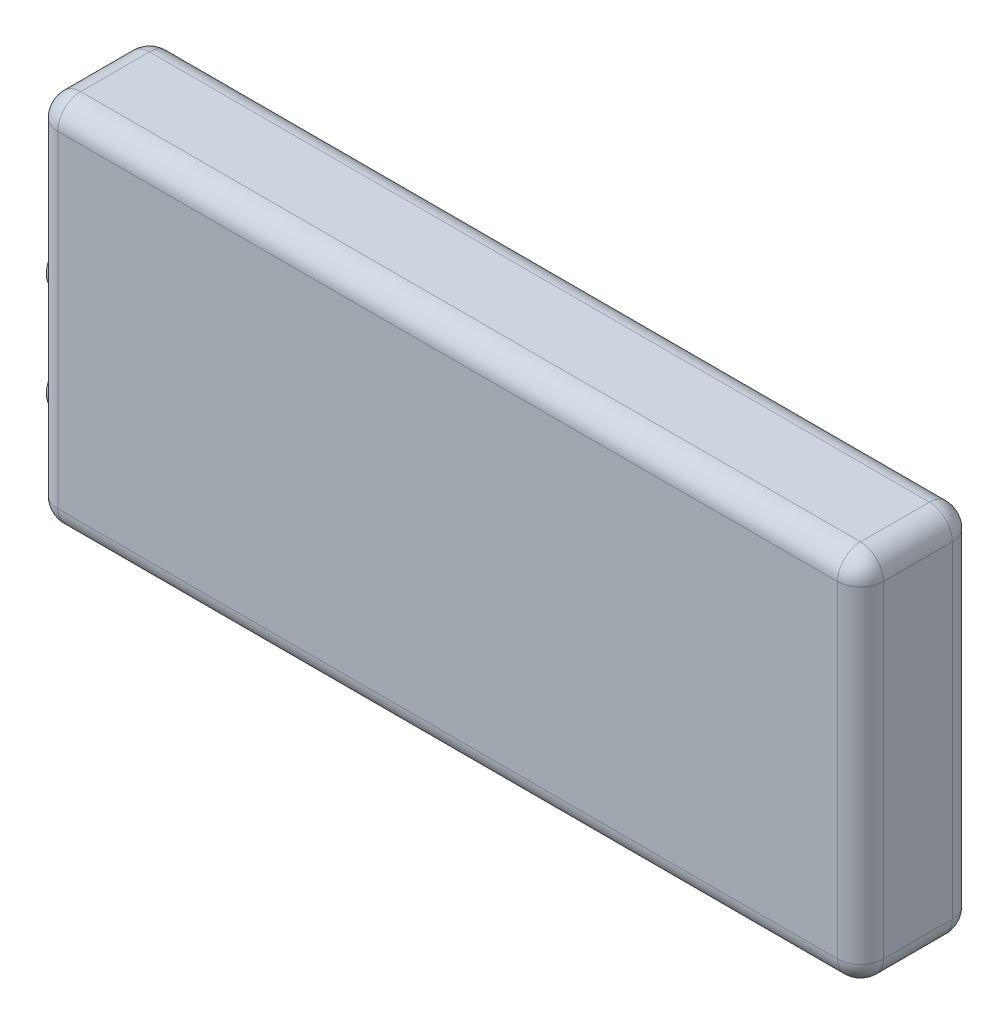
from build123d import *

# Parameters (mm, degrees)
SKETCH1_W           = 72
SKETCH1_H           = 32.5
BOSS_EXTRUDE1_DEPTH = 10
FILLET2_R           = 2
SKETCH2_R           = 3
SKETCH2_R_2         = 2
CUT_EXTRUDE1_DEPTH  = 3
BOSS_EXTRUDE2_START = 2
SKETCH3_R           = 2
BOSS_EXTRUDE2_DEPTH = 2
CUT_EXTRUDE2_DEPTH  = 1


with BuildPart() as part:
    # Sketch1 → Boss-Extrude1 (new body)
    with BuildSketch(Plane.XY):
        Rectangle(SKETCH1_W, SKETCH1_H)
    extrude(amount=BOSS_EXTRUDE1_DEPTH)

    # Fillet2
    fillet2_edges = [part.edges().sort_by_distance(p)[0] for p in [
        (-36, 0, 10),
        (0, -16.25, 10),
        (36, 0, 10),
        (0, -16.25, 0),
        (-36, 0, 0),
        (0, 16.25, 0),
        (36, 0, 0),
        (0, 16.25, 10),
        (36, -16.25, 5),
        (-36, -16.25, 5),
        (-36, 16.25, 5),
        (36, 16.25, 5),
    ]]
    fillet(fillet2_edges, radius=FILLET2_R)

    # Sketch2 → Cut-Extrude1 (cut)
    # profile 1 of 2: a face of its own
    with BuildSketch(Plane.ZY.offset(36)):
        with Locations(Location((5, 0, 0), (0, 0, 270))):
            Circle(SKETCH2_R)
        with Locations(Location((5, 0, 0), (0, 0, 270))):
            Circle(SKETCH2_R_2, mode=Mode.SUBTRACT)
    # profile 2 of 2: a face of its own
    with BuildSketch(Plane.ZY.offset(36)):
        with Locations(Location((5, -9.040456428, 0), (0, 0, 270))):
            Circle(SKETCH2_R)
        with Locations(Location((5, -9.040456428, 0), (0, 0, 270))):
            Circle(SKETCH2_R_2, mode=Mode.SUBTRACT)
    extrude(amount=-CUT_EXTRUDE1_DEPTH, mode=Mode.SUBTRACT)

    # Sketch3 → Boss-Extrude2 (add)
    with BuildSketch(Plane.ZY.offset(36).offset(BOSS_EXTRUDE2_START)):
        with Locations(Location((5, -9.040456428, 0), (0, 0, 270))):
            Circle(SKETCH3_R)
        with Locations(Location((5, 0, 0), (0, 0, 270))):
            Circle(SKETCH3_R)
    extrude(amount=-BOSS_EXTRUDE2_DEPTH)

    # Sketch4 → Cut-Extrude2 (cut)
    with BuildSketch(Plane(origin=(0, 0, 0), x_dir=(-1, 0, 0), z_dir=(0, 0, -1))):
        Polygon((-4.372559178, 2.480803128), (-2.487943794, 2.480803128), (-2.487943794, 1.852598), (-3.74435405, 1.852598), (-3.74435405, 1.179521077), (-2.487943794, 1.179521077), (-2.487943794, 0.551315949), (-3.74435405, 0.551315949), (-3.74435405, -0.390991744), (-2.487943794, -0.390991744), (-2.487943794, -1.019196872), (-4.372559178, -1.019196872), align=None)
        with BuildLine():
            Line((-0.06486687, 2.013154891), (-0.534618473, 1.583367231))
            add(Edge.make_bspline(
                [(-0.534618473, 1.583367231), (-0.554740617, 1.611751607), (-0.593372329, 1.666245652), (-0.655990303, 1.739214462), (-0.718325525, 1.801462288), (-0.780955493, 1.852729086), (-0.844435334, 1.892703372), (-0.908654858, 1.921005609), (-0.973249986, 1.938997609), (-1.01664794, 1.941238046), (-1.038023922, 1.94234159)],
                knots=[0, 0, 0, 0, 1.299362458, 2.494594718, 3.587462134, 4.587049575, 5.512617175, 6.380583204, 7.202344345, 8, 8, 8, 8], degree=3))
            add(Edge.make_bspline(
                [(-1.038023922, 1.94234159), (-1.057962824, 1.941642334), (-1.096459607, 1.940292254), (-1.151339626, 1.926872565), (-1.200062889, 1.903712153), (-1.242581843, 1.873427965), (-1.276263128, 1.83694254), (-1.303155022, 1.798678711), (-1.318297418, 1.756444096), (-1.320290455, 1.72743566), (-1.321277127, 1.713074763)],
                knots=[0, 0, 0, 0, 1.185010067, 2.2879431, 3.333075148, 4.379039566, 5.372662701, 6.27520591, 7.14612461, 8, 8, 8, 8], degree=3))
            add(Edge.make_bspline(
                [(-1.321277127, 1.713074763), (-1.32065883, 1.698506775), (-1.319413665, 1.669168873), (-1.307387071, 1.626170523), (-1.28925956, 1.58415613), (-1.271937984, 1.55857997), (-1.263084018, 1.545506654)],
                knots=[0, 0, 0, 0, 0.967525499, 1.948461899, 2.951351359, 4, 4, 4, 4], degree=3))
            add(Edge.make_bspline(
                [(-1.263084018, 1.545506654), (-1.255034805, 1.535344902), (-1.236506581, 1.511953892), (-1.201177052, 1.474906177), (-1.156810583, 1.429519485), (-1.101699859, 1.377354529), (-1.038132679, 1.316535254), (-0.96316262, 1.249452489), (-0.878947649, 1.174028759), (-0.819089598, 1.121506404), (-0.787723441, 1.093984218)],
                knots=[0, 0, 0, 0, 0.473873513, 1.090794244, 1.870441696, 2.795289791, 3.865433203, 5.087734844, 6.473946851, 8, 8, 8, 8], degree=3))
            add(Edge.make_bspline(
                [(-0.787723441, 1.093984218), (-0.758281791, 1.068503954), (-0.702407655, 1.020147708), (-0.622909855, 0.95151378), (-0.553044529, 0.889765509), (-0.491793899, 0.835829604), (-0.440086464, 0.789140154), (-0.397704847, 0.749473983), (-0.364131427, 0.717603319), (-0.345046904, 0.698353419), (-0.336902127, 0.690138064)],
                knots=[0, 0, 0, 0, 1.543621617, 2.929473131, 4.163658386, 5.240097082, 6.164993805, 6.925417477, 7.541396219, 8, 8, 8, 8], degree=3))
            add(Edge.make_bspline(
                [(-0.336902127, 0.690138064), (-0.306002542, 0.656698096), (-0.24660269, 0.592414733), (-0.169403821, 0.492795739), (-0.105866655, 0.395547287), (-0.056713098, 0.298839491), (-0.019590355, 0.20127705), (0.006581671, 0.10046725), (0.022256271, -0.004643308), (0.023996517, -0.076368433), (0.024876719, -0.112646391)],
                knots=[0, 0, 0, 0, 1.206664779, 2.319633467, 3.337109185, 4.282041471, 5.190008762, 6.099243693, 7.03861361, 8, 8, 8, 8], degree=3))
            add(Edge.make_bspline(
                [(0.024876719, -0.112646391), (0.024250214, -0.147994813), (0.023020988, -0.217349731), (0.00796532, -0.318840323), (-0.013503179, -0.415971225), (-0.046697243, -0.507685514), (-0.087153973, -0.595488654), (-0.137872326, -0.678012949), (-0.197434078, -0.75609358), (-0.265700991, -0.82833476), (-0.341212303, -0.893888624), (-0.422205362, -0.952246222), (-0.509472158, -1.000427852), (-0.602267097, -1.040101988), (-0.70054051, -1.070659538), (-0.804175322, -1.093244415), (-0.913330049, -1.106799503), (-0.987971625, -1.108216526), (-1.026104851, -1.108940462)],
                knots=[0, 0, 0, 0, 1.043214005, 2.046824704, 3.02475056, 3.976699089, 4.921714032, 5.875962561, 6.831408892, 7.817874052, 8.806269674, 9.781291748, 10.760897367, 11.74438705, 12.757449933, 13.795994037, 14.874007457, 16, 16, 16, 16], degree=3))
            add(Edge.make_bspline(
                [(-1.026104851, -1.108940462), (-1.056039109, -1.108409408), (-1.115326107, -1.107357617), (-1.202706178, -1.098770621), (-1.287081515, -1.084912121), (-1.368357076, -1.065048752), (-1.446899021, -1.03987917), (-1.522710577, -1.009135489), (-1.595268391, -0.972341194), (-1.66512147, -0.930252922), (-1.731930242, -0.881382895), (-1.796539477, -0.826730243), (-1.858307415, -0.765454385), (-1.917530715, -0.697700236), (-1.973830449, -0.623275932), (-2.029049511, -0.54321797), (-2.080733799, -0.456040582), (-2.112661483, -0.394884939), (-2.128969435, -0.363647994)],
                knots=[0, 0, 0, 0, 1.016823716, 2.013894106, 2.979844003, 3.91962641, 4.853723003, 5.779685073, 6.695824784, 7.614987388, 8.547259901, 9.504950863, 10.487499108, 11.500346958, 12.559593716, 13.656357062, 14.802919212, 16, 16, 16, 16], degree=3))
            Line((-2.128969435, -0.363647994), (-1.57648546, -0.032017385))
            add(Edge.make_bspline(
                [(-1.57648546, -0.032017385), (-1.55608665, -0.067475399), (-1.516980386, -0.135451442), (-1.450711167, -0.226785871), (-1.382821735, -0.30499869), (-1.311742547, -0.368707484), (-1.238337901, -0.418764121), (-1.162253233, -0.454538066), (-1.083435089, -0.476682098), (-1.02974775, -0.479386396), (-1.002967832, -0.480735334)],
                knots=[0, 0, 0, 0, 1.283663364, 2.460892379, 3.537111102, 4.529833553, 5.449777664, 6.316464042, 7.160231139, 8, 8, 8, 8], degree=3))
            add(Edge.make_bspline(
                [(-1.002967832, -0.480735334), (-0.975728821, -0.479633718), (-0.922881173, -0.477496423), (-0.847447917, -0.457754876), (-0.778287853, -0.426759199), (-0.718506403, -0.382532642), (-0.667887241, -0.331488473), (-0.630527394, -0.274699501), (-0.607057686, -0.213255204), (-0.604576369, -0.170571954), (-0.603328409, -0.149104725)],
                knots=[0, 0, 0, 0, 1.13588714, 2.203786484, 3.234766741, 4.283437687, 5.291419208, 6.222934724, 7.106237994, 8, 8, 8, 8], degree=3))
            add(Edge.make_bspline(
                [(-0.603328409, -0.149104725), (-0.604480849, -0.129132961), (-0.606821921, -0.088562236), (-0.624065537, -0.028240092), (-0.651022568, 0.03205462), (-0.682914637, 0.081509973), (-0.71536881, 0.1229176), (-0.74640232, 0.158795435), (-0.784192926, 0.198434162), (-0.828644807, 0.241883644), (-0.879170638, 0.289526376), (-0.935812981, 0.341357694), (-0.99922045, 0.396921026), (-1.044036974, 0.434770218), (-1.067471037, 0.454561141)],
                knots=[0, 0, 0, 0, 0.916159276, 1.861089862, 2.860218735, 3.940849679, 4.552606315, 5.27541173, 6.11797699, 7.06649574, 8.129236253, 9.306560635, 10.591630461, 12, 12, 12, 12], degree=3))
            add(Edge.make_bspline(
                [(-1.067471037, 0.454561141), (-1.112020124, 0.49225394), (-1.197523304, 0.56459783), (-1.318350147, 0.671447478), (-1.427225951, 0.771308265), (-1.523210347, 0.865414688), (-1.607526326, 0.952028819), (-1.679602864, 1.031854173), (-1.738648166, 1.105506492), (-1.800780615, 1.192742734), (-1.859818863, 1.29904609), (-1.910844664, 1.426941351), (-1.94394805, 1.554820383), (-1.947656824, 1.640671322), (-1.949482255, 1.682926525)],
                knots=[0, 0, 0, 0, 1.345494975, 2.582412109, 3.71882943, 4.751509156, 5.681369928, 6.505683931, 7.230279997, 7.856715994, 8.973648664, 10.023341002, 11.027102913, 12, 12, 12, 12], degree=3))
            add(Edge.make_bspline(
                [(-1.949482255, 1.682926525), (-1.948723061, 1.712891648), (-1.947227366, 1.771926158), (-1.933885539, 1.858727803), (-1.913945669, 1.942484097), (-1.884987255, 2.022889459), (-1.847402729, 2.099843179), (-1.801757782, 2.173721976), (-1.747343635, 2.243845887), (-1.686022565, 2.310168425), (-1.618462446, 2.370779677), (-1.546265873, 2.42427518), (-1.469841485, 2.46945826), (-1.389656808, 2.506940906), (-1.305214971, 2.53563149), (-1.217138052, 2.555968806), (-1.125299722, 2.568064793), (-1.062833273, 2.569709102), (-1.031012704, 2.570546718)],
                knots=[0, 0, 0, 0, 1.010766082, 1.991317756, 2.957454644, 3.913069143, 4.869106762, 5.843196583, 6.838735724, 7.860187025, 8.887984031, 9.89767229, 10.887916223, 11.879572884, 12.879850636, 13.892031539, 14.926195476, 16, 16, 16, 16], degree=3))
            add(Edge.make_bspline(
                [(-1.031012704, 2.570546718), (-0.989774821, 2.569038148), (-0.907624573, 2.566032917), (-0.786163063, 2.542532992), (-0.667524537, 2.505576884), (-0.57192339, 2.460993406), (-0.495855342, 2.41780537), (-0.437556288, 2.378043267), (-0.378233863, 2.33249364), (-0.317409669, 2.281012952), (-0.256213912, 2.222631238), (-0.192906504, 2.15873832), (-0.128350087, 2.088782015), (-0.086398652, 2.038805555), (-0.06486687, 2.013154891)],
                knots=[0, 0, 0, 0, 1.282922637, 2.555718331, 3.837320111, 5.142675274, 5.830281639, 6.55870424, 7.337177975, 8.157850921, 9.037902056, 9.96903443, 10.957596896, 12, 12, 12, 12], degree=3))
        make_face()
        with BuildLine():
            Line((3.794107488, 1.873631654), (3.333470469, 1.433327166))
            add(Edge.make_bspline(
                [(3.333470469, 1.433327166), (3.294395485, 1.473730766), (3.218069798, 1.552651654), (3.095080393, 1.657135955), (2.96717589, 1.744209483), (2.836844415, 1.817542253), (2.701741684, 1.873023721), (2.563429852, 1.913454), (2.421025757, 1.938102814), (2.324652142, 1.940923074), (2.276178803, 1.94234159)],
                knots=[0, 0, 0, 0, 1.115251505, 2.178435587, 3.19620269, 4.182487026, 5.141301733, 6.088180966, 7.038406374, 8, 8, 8, 8], degree=3))
            add(Edge.make_bspline(
                [(2.276178803, 1.94234159), (2.235697673, 1.941220913), (2.155812625, 1.939009381), (2.03852044, 1.922796671), (1.926324403, 1.895226252), (1.81884045, 1.857229107), (1.716384856, 1.808062818), (1.618742811, 1.747765439), (1.526155048, 1.676881541), (1.439844596, 1.59577788), (1.360890828, 1.507166035), (1.291130146, 1.412617409), (1.232694385, 1.312348606), (1.184737107, 1.207375075), (1.14738024, 1.097210946), (1.120702745, 0.981930388), (1.105273194, 0.861396108), (1.10297023, 0.779457803), (1.101799796, 0.737814346)],
                knots=[0, 0, 0, 0, 1.035432265, 2.043311493, 3.022114605, 3.98653278, 4.95457646, 5.923598177, 6.917315552, 7.932509744, 8.948865224, 9.949768934, 10.933144597, 11.912367597, 12.897413939, 13.903909035, 14.934704909, 16, 16, 16, 16], degree=3))
            add(Edge.make_bspline(
                [(1.101799796, 0.737814346), (1.102137102, 0.708586054), (1.102801938, 0.65097649), (1.11007975, 0.565755956), (1.121798742, 0.483071892), (1.138759027, 0.40304954), (1.159968031, 0.325619553), (1.184851021, 0.250113948), (1.216066367, 0.17757604), (1.250715871, 0.107163349), (1.291012846, 0.040797175), (1.334460418, -0.022488481), (1.381572216, -0.082383397), (1.432653387, -0.138642722), (1.488422834, -0.190387248), (1.547439123, -0.239172995), (1.610697777, -0.28377869), (1.676884755, -0.325323762), (1.746571827, -0.36141432), (1.817868221, -0.394105393), (1.891854936, -0.420655405), (1.967631138, -0.442057137), (2.04492603, -0.460256113), (2.124495627, -0.471461782), (2.205650161, -0.479947704), (2.260497004, -0.48047166), (2.288097873, -0.480735334)],
                knots=[0, 0, 0, 0, 1.103660481, 2.175337485, 3.227646561, 4.255952547, 5.262355991, 6.258840057, 7.255597736, 8.242457506, 9.22035537, 10.185017736, 11.140346927, 12.096287581, 13.051739095, 14.01125915, 14.986044842, 15.97314143, 16.960198552, 17.947847494, 18.933482797, 19.925264591, 20.920966487, 21.929612487, 22.958107872, 24, 24, 24, 24], degree=3))
            add(Edge.make_bspline(
                [(2.288097873, -0.480735334), (2.33491369, -0.479381172), (2.426894596, -0.476720596), (2.561889802, -0.455915269), (2.690526784, -0.421691683), (2.793307118, -0.381275617), (2.873832794, -0.341364227), (2.935135801, -0.304448157), (2.998527888, -0.26315348), (3.062956167, -0.215921689), (3.129145328, -0.163319585), (3.19592698, -0.104195084), (3.265010745, -0.040495071), (3.310266834, 0.00496888), (3.333470469, 0.02827909)],
                knots=[0, 0, 0, 0, 1.404581149, 2.759636711, 4.088442092, 5.392261763, 6.066678138, 6.783632037, 7.538459478, 8.336747902, 9.180226004, 10.074962426, 11.012997595, 12, 12, 12, 12], degree=3))
            Line((3.333470469, 0.02827909), (3.780085053, -0.440771391))
            add(Edge.make_bspline(
                [(3.780085053, -0.440771391), (3.748690451, -0.471081893), (3.687414904, -0.530241511), (3.594982441, -0.614242647), (3.502666308, -0.689727007), (3.412696671, -0.75943434), (3.323599732, -0.821333904), (3.235384941, -0.875487517), (3.149050927, -0.923264804), (3.062804938, -0.963860023), (2.976110305, -0.998329581), (2.886911716, -1.028005607), (2.794936482, -1.053110458), (2.699622861, -1.073366776), (2.601859879, -1.089609608), (2.500732605, -1.100573426), (2.396882237, -1.107944035), (2.326438923, -1.108606346), (2.29090236, -1.108940462)],
                knots=[0, 0, 0, 0, 1.244526981, 2.429050516, 3.560637417, 4.644440555, 5.67424972, 6.652764056, 7.595344123, 8.486817594, 9.369275933, 10.254498637, 11.166417451, 12.086725134, 13.032340136, 13.991389299, 14.986715468, 16, 16, 16, 16], degree=3))
            add(Edge.make_bspline(
                [(2.29090236, -1.108940462), (2.225626096, -1.10727644), (2.097898592, -1.104020411), (1.910717266, -1.079895442), (1.73290003, -1.039450357), (1.564014289, -0.98224985), (1.404113745, -0.909178884), (1.253239305, -0.819597311), (1.111634144, -0.713743135), (0.980442155, -0.592857069), (0.861772758, -0.459348558), (0.756882753, -0.315997044), (0.670117736, -0.162098006), (0.598074874, 7.4974e-05), (0.541738303, 0.171261956), (0.502086908, 0.35164811), (0.477634181, 0.541059264), (0.474959018, 0.670431449), (0.473594668, 0.736412102)],
                knots=[0, 0, 0, 0, 1.078019885, 2.10938526, 3.111377082, 4.085535484, 5.04941344, 6.010039228, 6.978205633, 7.964457913, 8.951525778, 9.924444315, 10.892603023, 11.863865945, 12.85144698, 13.863884204, 14.910567087, 16, 16, 16, 16], degree=3))
            add(Edge.make_bspline(
                [(0.473594668, 0.736412102), (0.474171176, 0.779444122), (0.475313675, 0.864723066), (0.487321442, 0.990345861), (0.504060968, 1.112805615), (0.530616704, 1.230830791), (0.562627024, 1.346011405), (0.602436063, 1.457095579), (0.649980241, 1.564402579), (0.703727095, 1.668112045), (0.764530374, 1.767544568), (0.832454311, 1.861845865), (0.90575028, 1.951743927), (0.986179463, 2.036046087), (1.072573119, 2.115492535), (1.165321305, 2.189652736), (1.263866188, 2.259590231), (1.368474491, 2.323501501), (1.477113954, 2.381312642), (1.588414348, 2.432304537), (1.70210222, 2.474922019), (1.817696888, 2.510271649), (1.935686738, 2.536657647), (2.055229588, 2.556630997), (2.177342604, 2.567796227), (2.259330916, 2.569624047), (2.300718065, 2.570546718)],
                knots=[0, 0, 0, 0, 1.071919942, 2.124283339, 3.142214191, 4.149696895, 5.136002878, 6.119640489, 7.086990633, 8.058538607, 9.028339693, 9.988281803, 10.952401235, 11.916291999, 12.888973767, 13.874849856, 14.873389453, 15.898127285, 16.927174885, 17.938320013, 18.946391617, 19.950418109, 20.947802303, 21.956882652, 22.968648068, 24, 24, 24, 24], degree=3))
            add(Edge.make_bspline(
                [(2.300718065, 2.570546718), (2.336025548, 2.57001782), (2.406273413, 2.568965523), (2.510884272, 2.560193482), (2.614658502, 2.546417081), (2.71722456, 2.525631426), (2.819316103, 2.500956227), (2.919591534, 2.468647457), (3.019632752, 2.432633245), (3.117870758, 2.389585607), (3.21444268, 2.342595223), (3.307086167, 2.289282925), (3.397356695, 2.232929493), (3.483253923, 2.170199684), (3.566386892, 2.103368825), (3.646320892, 2.032125112), (3.722354454, 1.955280704), (3.770068897, 1.900985594), (3.794107488, 1.873631654)],
                knots=[0, 0, 0, 0, 0.996412454, 1.982464992, 2.961075852, 3.949442424, 4.934965278, 5.923860011, 6.921385422, 7.934793307, 8.949617135, 9.951082467, 10.950285876, 11.951772932, 12.951063433, 13.960125323, 14.972308753, 16, 16, 16, 16], degree=3))
        make_face()
    extrude(amount=-CUT_EXTRUDE2_DEPTH, mode=Mode.SUBTRACT)


solid = part.part
